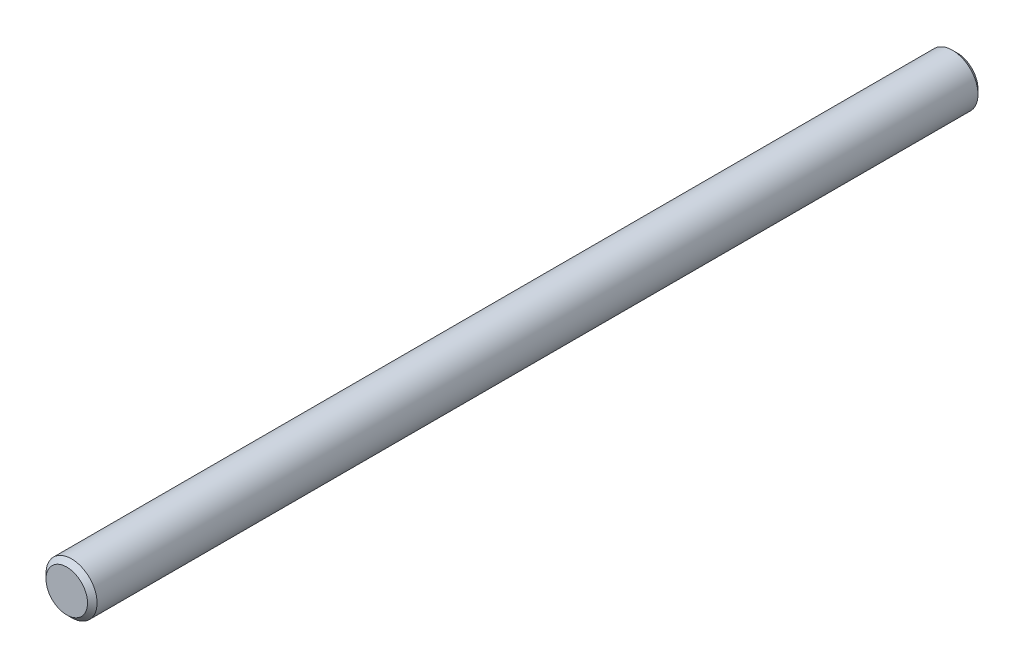
from build123d import *

# Parameters (mm, degrees)
SKETCH1_R      = 1.0922
EXTRUDE1_DEPTH = 38.1
CHAMFER1_SIZE  = 0.2032


with BuildPart() as part:
    # Sketch1 → Extrude1 (new body)
    with BuildSketch(Plane.XY):
        Circle(SKETCH1_R)
    extrude(amount=-EXTRUDE1_DEPTH)

    # Chamfer1
    chamfer1_edges = [part.edges().sort_by_distance(p)[0] for p in [
        (-1.0922, 0, 0),
        (-1.0922, 0, -38.1),
    ]]
    chamfer(chamfer1_edges, length=CHAMFER1_SIZE)


solid = part.part
